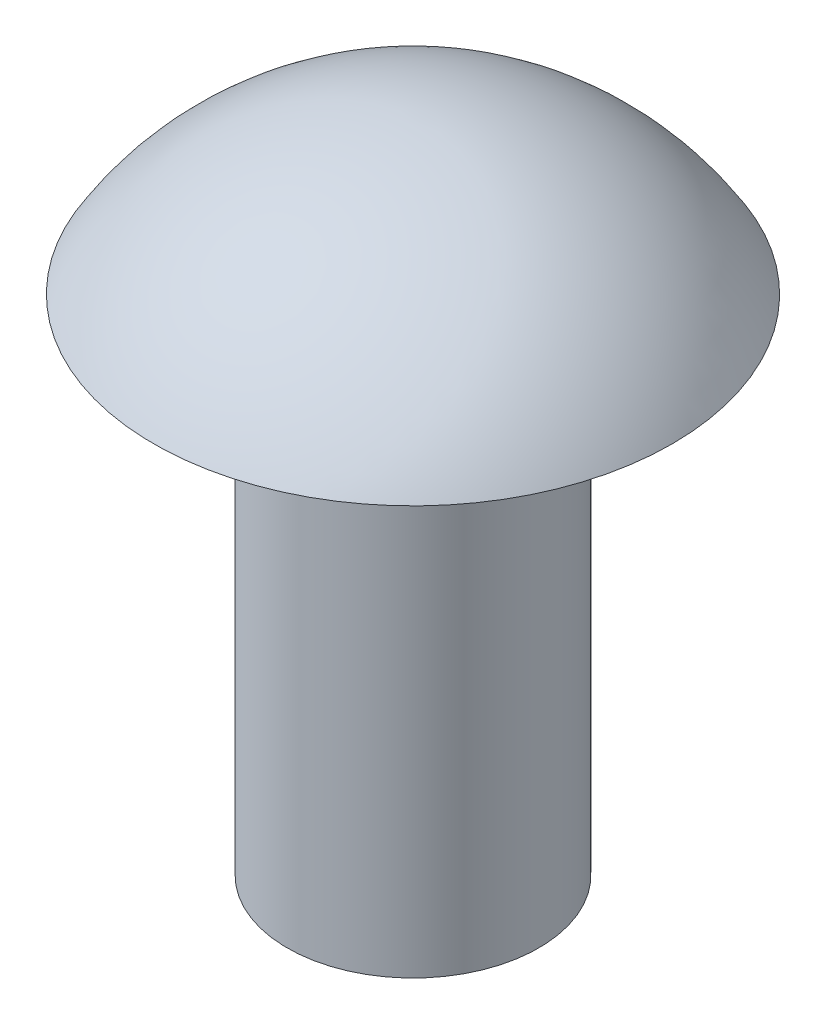
from build123d import *


with BuildPart() as part:
    # Schizzo1 → Rivoluzione1 (revolve)
    with BuildSketch(Plane.XY, mode=Mode.PRIVATE) as rivoluzione1_sk:
        with BuildLine():
            Line((0, -6.923821102), (2.5, -6.923821102))
            Line((2.5, -6.923821102), (2.5, 3.076178898))
            Line((2.5, 3.076178898), (5.151419551, 3.076178898))
            ThreePointArc((5.151419551, 3.076178898), (2.96166563, 5.218097038), (0, 6))
            Line((0, 6), (0, -6.923821102))
        make_face()
    revolve(rivoluzione1_sk.sketch.rotate(Axis((0, 30.789570349, 0), (0, -1, 0)), 180), axis=Axis((0, 30.789570349, 0), (0, -1, 0)))


solid = part.part
